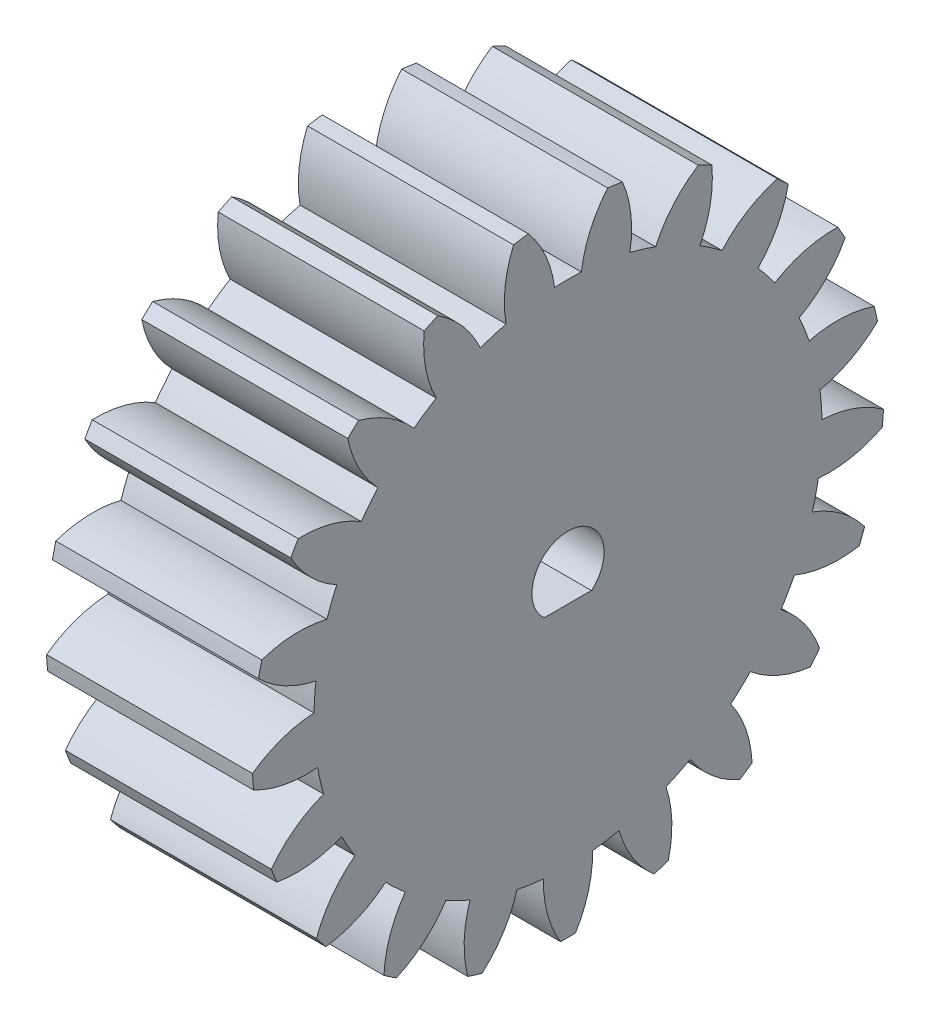
from build123d import *

# Parameters (mm, degrees)
BASPROSKE_W         = 15
BASPROSKE_H         = 23
TOOTHCUT_DEPTH      = 36.818989377
TEETHCUTS_COUNT     = 21
TEETHCUTS_ANGLE     = 342.857142857
BORSKE_R            = 2.5
BORE_DEPTH          = 50.0000508
SKETCH_1_R          = 2.625
CUT_EXTRUDE_1_DEPTH = 15
SKETCH_3_W          = 3.458323293
SKETCH_3_H          = 0.848920995
EXTRUDE_1_DEPTH     = 15


with BuildPart() as part:
    # BasProSke → Base-Revolve (revolve)
    with BuildSketch(Plane(origin=(0, 0, 0), x_dir=(1, 0, 0), z_dir=(0, 1, 0)), mode=Mode.PRIVATE) as base_revolve_sk:
        with Locations((7.5, 11.5)):
            Rectangle(BASPROSKE_W, BASPROSKE_H)
    revolve(base_revolve_sk.sketch.rotate(Axis((-10, 0, 0), (1, 0, 0)), 180), axis=Axis((-10, 0, 0), (1, 0, 0)))

    # TooCutSke → ToothCut (cut, through all)
    with BuildSketch(Plane(origin=(0, 0, 0), x_dir=(0, 0, -1), z_dir=(1, 0, 0))):
        with BuildLine():
            ThreePointArc((0.976779145, 18.473194188), (0, 18.499), (-0.976779145, 18.473194188))
            ThreePointArc((-0.976779145, 18.473194188), (-1.625451341, 20.797249275), (-2.90802115, 22.841025768))
            ThreePointArc((-2.90802115, 22.841025768), (0, 23.0254), (2.90802115, 22.841025768))
            ThreePointArc((2.90802115, 22.841025768), (1.625451341, 20.797249275), (0.976779145, 18.473194188))
        make_face()
    toothcut = extrude(amount=TOOTHCUT_DEPTH, mode=Mode.SUBTRACT)

    # TeethCuts: ToothCut ×21 about axis
    teethcuts_axis = Axis((-10, 0, 0), (1, 0, 0))
    for i in range(1, TEETHCUTS_COUNT):
        add(toothcut.rotate(teethcuts_axis, i * TEETHCUTS_ANGLE / (TEETHCUTS_COUNT - 1)), mode=Mode.SUBTRACT)

    # BorSke → Bore (cut, symmetric)
    with BuildSketch(Plane(origin=(0, 0, 0), x_dir=(0, 0, -1), z_dir=(1, 0, 0))):
        with Locations(Location((0, 0, 0), (0, 0, 180))):
            Circle(BORSKE_R)
    extrude(amount=BORE_DEPTH, both=True, mode=Mode.SUBTRACT)

    # 草圖1 → 除料-伸長1 (cut)
    with BuildSketch(Plane.ZY):
        Circle(SKETCH_1_R)
    extrude(amount=-CUT_EXTRUDE_1_DEPTH, mode=Mode.SUBTRACT)

    # 草圖3 → 填料-伸長1 (add)
    with BuildSketch(Plane.ZY):
        with Locations((0.024656151, -2.399460498)):
            Rectangle(SKETCH_3_W, SKETCH_3_H)
    extrude(amount=-EXTRUDE_1_DEPTH)


solid = part.part
